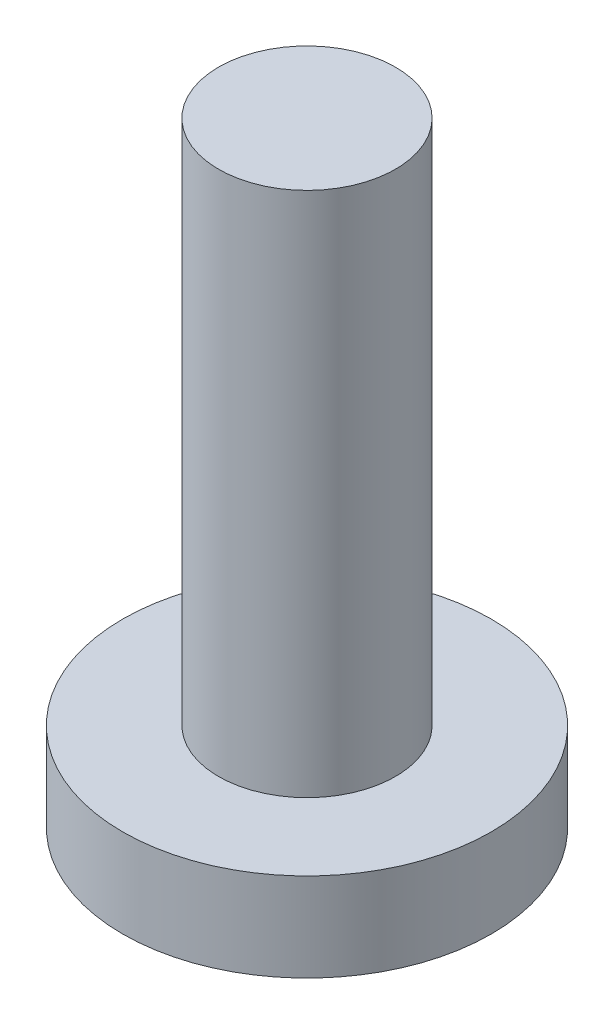
from build123d import *


with BuildPart() as part:
    # Sketch1 → Revolve1 (revolve)
    with BuildSketch(Plane.XY, mode=Mode.PRIVATE) as revolve1_sk:
        Polygon((0, 0), (0, -7.9375), (2.38125, -7.9375), (2.38125, -6.7945), (1.143, -6.7945), (1.143, 0), align=None)
    revolve(revolve1_sk.sketch.rotate(Axis((0, 0, 0), (0, -1, 0)), 180), axis=Axis((0, 0, 0), (0, -1, 0)))


solid = part.part
